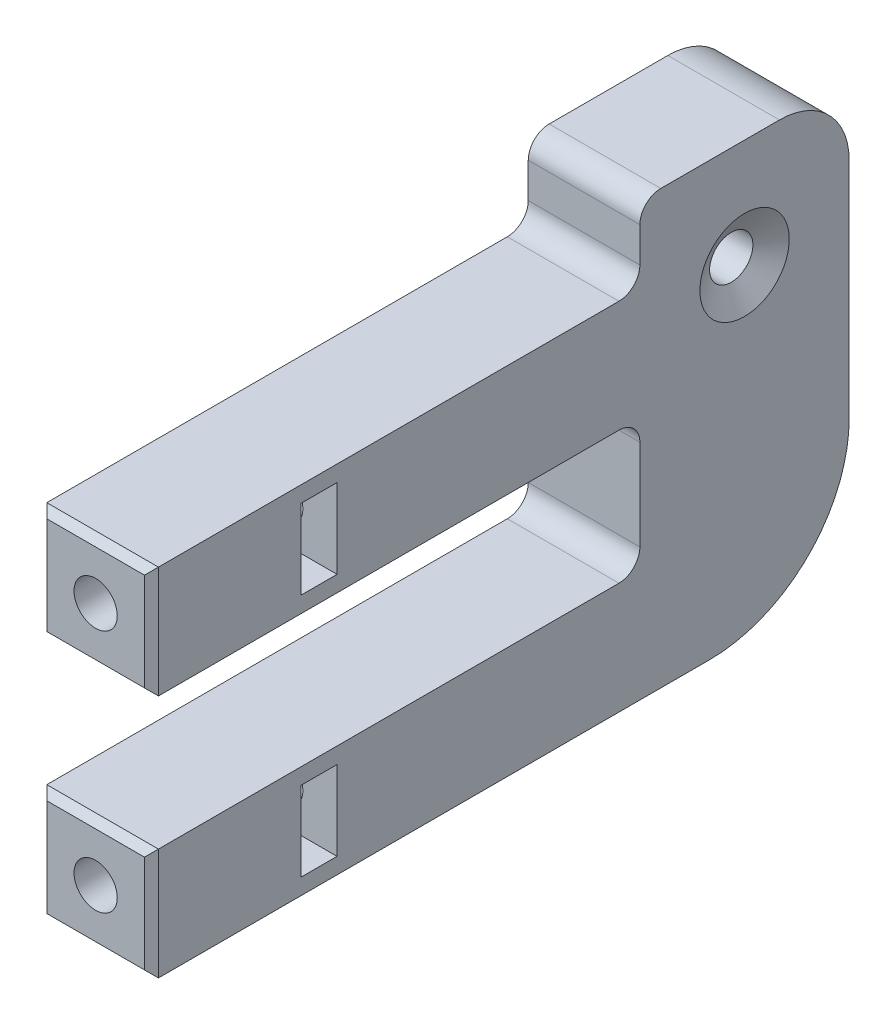
from build123d import *
from build123d.topology import SkipClean

# Parameters (mm, degrees)
SKETCH1_R           = 1.55
BOSS_EXTRUDE1_DEPTH = 8
SKETCH2_R           = 3.2
CUT_EXTRUDE1_DEPTH  = 1.5
CUT_EXTRUDE1_DRAFT  = -60
BOSS_EXTRUDE2_START = 0.75
SKETCH3_R           = 2.5
SKETCH3_R_2         = 1.55
BOSS_EXTRUDE2_DEPTH = 0.75
SKETCH4_R           = 1.55
CUT_EXTRUDE2_DEPTH  = 20
SKETCH5_W           = 2.6
SKETCH5_H           = 5.7
CUT_EXTRUDE3_DEPTH  = 60.371710435
FILLET2_R           = 1.5
FILLET3_R           = 5
FILLET4_R           = 10
CHAMFER1_SIZE       = 0.5


with BuildPart() as part:
    # Sketch1 → Boss-Extrude1 (new body)
    with BuildSketch(Plane(origin=(0, 0, 0), x_dir=(0, 0, -1), z_dir=(1, 0, 0))):
        Polygon((0, 0), (50, 0), (50, 31), (35, 31), (35, 25.5), (0, 25.5), (0, 17.5), (35, 17.5), (35, 8), (0, 8), align=None)
        with Locations((42.5, 23.25)):
            Circle(SKETCH1_R, mode=Mode.SUBTRACT)
    extrude(amount=BOSS_EXTRUDE1_DEPTH)


with BuildPart() as cut_extrude1_tool:
    # Sketch2 → Cut-Extrude1 (with draft: the straight prism first)
    with BuildSketch(Plane(origin=(8, 0, 0), x_dir=(0, 0, -1), z_dir=(1, 0, 0))):
        with Locations((42.5, 23.25)):
            Circle(SKETCH2_R)
    extrude(amount=-CUT_EXTRUDE1_DEPTH)
    # Cut-Extrude1: the draft: its side faces are tilted about the plane it starts from
    cut_extrude1_sides = [cut_extrude1_tool.faces().sort_by_distance(p)[0] for p in [
        (7.25, 23.25, -39.3),
    ]]
    draft(cut_extrude1_sides, Plane(origin=(8, 0, 0), x_dir=(0, 0, -1), z_dir=(1, 0, 0)), CUT_EXTRUDE1_DRAFT)


with BuildPart() as part_1:
    add(part.part)

    # Cut-Extrude1: cut by cut_extrude1_tool
    add(cut_extrude1_tool.part, mode=Mode.SUBTRACT)

    # Sketch3 → Boss-Extrude2 (add)
    with SkipClean():  # the faces are left unmerged after this step: merging them gives an invalid solid
        with BuildSketch(Plane.ZY.offset(BOSS_EXTRUDE2_START)):
            with Locations(Location((-42.5, 23.25, 0), (0, 0, 180))):
                Circle(SKETCH3_R)
            with Locations((-42.5, 23.25)):
                Circle(SKETCH3_R_2, mode=Mode.SUBTRACT)
        extrude(amount=-BOSS_EXTRUDE2_DEPTH)

    # Sketch4 → Cut-Extrude2 (cut)
    with SkipClean():  # the faces are left unmerged after this step: merging them gives an invalid solid
        with BuildSketch(Plane.XY):
            with Locations((4, 21.5)):
                Circle(SKETCH4_R)
            with Locations((4, 4)):
                Circle(SKETCH4_R)
        extrude(amount=-CUT_EXTRUDE2_DEPTH, mode=Mode.SUBTRACT)

    # Sketch5 → Cut-Extrude3 (cut, through all)
    with SkipClean():  # the faces are left unmerged after this step: merging them gives an invalid solid
        with BuildSketch(Plane.ZY):
            with Locations((-12, 21.5)):
                Rectangle(SKETCH5_W, SKETCH5_H)
            with Locations((-12, 4)):
                Rectangle(SKETCH5_W, SKETCH5_H)
        extrude(amount=-CUT_EXTRUDE3_DEPTH, mode=Mode.SUBTRACT)

    # Fillet2
    fillet2_edges = [part_1.edges().sort_by_distance(p)[0] for p in [
        (4, 8, -35),
        (4, 17.5, -35),
        (4, 25.5, -35),
        (4, 31, -35),
    ]]
    fillet(fillet2_edges, radius=FILLET2_R)

    # Fillet3
    fillet3_edges = [part_1.edges().sort_by_distance(p)[0] for p in [
        (4, 31, -50),
    ]]
    fillet(fillet3_edges, radius=FILLET3_R)

    # Fillet4
    fillet4_edges = [part_1.edges().sort_by_distance(p)[0] for p in [
        (4, 0, -50),
    ]]
    fillet(fillet4_edges, radius=FILLET4_R)

    # Chamfer1
    chamfer1_edges = [part_1.edges().sort_by_distance(p)[0] for p in [
        (0, 21.5, 0),
        (0, 4, 0),
        (4, 8, 0),
        (4, 17.5, 0),
        (4, 25.5, 0),
        (4, 0, 0),
        (8, 21.5, 0),
        (8, 4, 0),
    ]]
    chamfer(chamfer1_edges, length=CHAMFER1_SIZE)


solid = part_1.part
